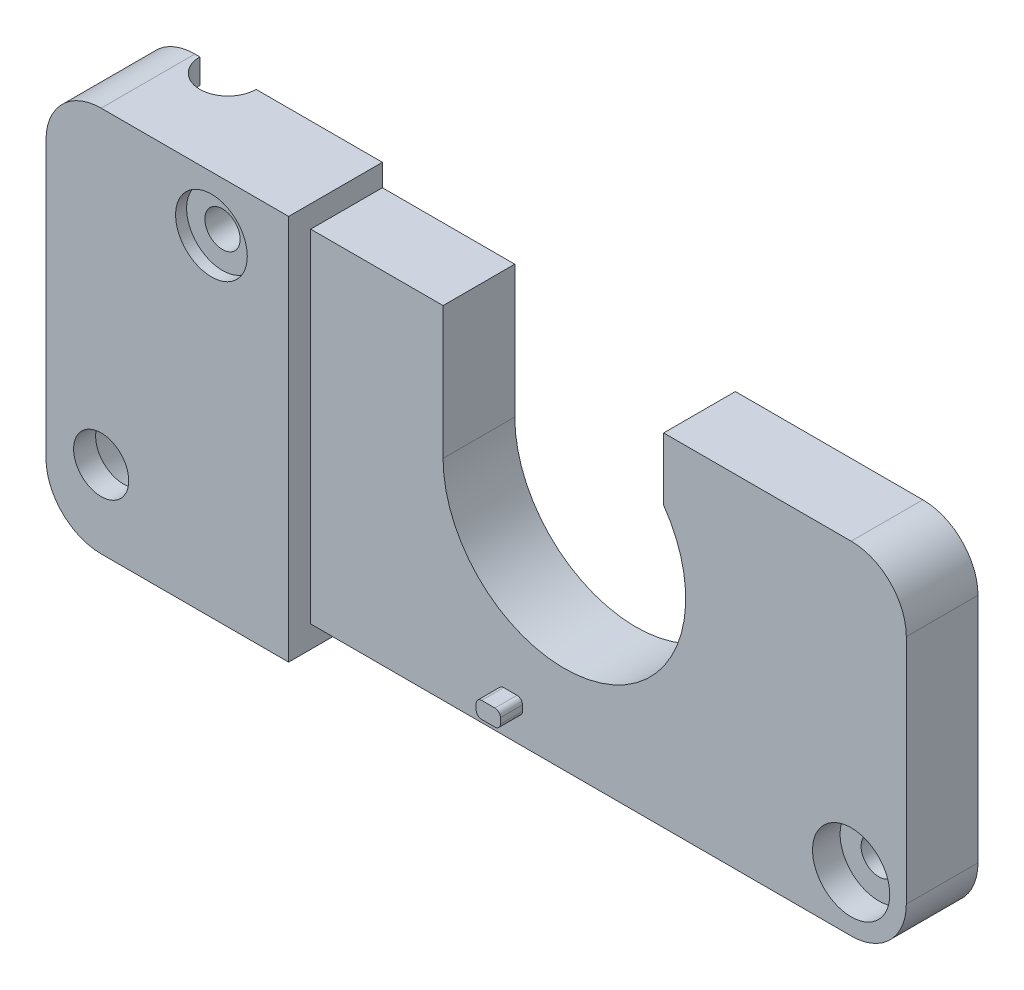
from build123d import *

# Parameters (mm, degrees)
BOSS_EXTRUDE1_DEPTH  = 17
CUT_EXTRUDE1_START   = -17
SKETCH3_W            = 12
SKETCH3_H            = 2
CUT_EXTRUDE1_DEPTH   = 17
CUT_EXTRUDE2_START   = -2
CUT_EXTRUDE2_DEPTH   = 2
SKETCH5_W            = 60
SKETCH5_H            = 35
CUT_EXTRUDE3_DEPTH   = 2
CUT_EXTRUDE4_DEPTH   = 11
CUT_EXTRUDE11_DEPTH  = 13
BOSS_EXTRUDE2_DEPTH  = 2
SKETCH13_R           = 2.5
CUT_EXTRUDE12_DEPTH  = 5
SKETCH14_R           = 2.55
CUT_EXTRUDE14_DEPTH  = 15
BOSS_EXTRUDE5_REACH  = 87.381
SKETCH15_R           = 3.25
SKETCH15_R_2         = 1.6
SKETCH15_4_R         = 3.25
SKETCH15_4_R_2       = 1.6
CUT_EXTRUDE16_DEPTH  = 1
SKETCH18_R           = 1.6
CUT_EXTRUDE17_DEPTH  = 15
SKETCH20_R           = 4.5
SKETCH20_R_2         = 1.6
BOSS_EXTRUDE6_DEPTH  = 13
SKETCH20_3_R         = 1.6
CUT_EXTRUDE20_DEPTH  = 86.005882191
SKETCH22_W           = 13
SKETCH22_H           = 31
SKETCH22_W_2         = 11
SKETCH22_H_2         = 29
BOSS_EXTRUDE7_DEPTH  = 3
SKETCH21_R           = 3.5
CUT_EXTRUDE21_DEPTH  = 2
SKETCH29_R           = 3.5
CUT_EXTRUDE22_DEPTH  = 2.5
BOSS_EXTRUDE10_DEPTH = 13
SKETCH24_W           = 80
SKETCH24_H           = 36
CUT_EXTRUDE23_DEPTH  = 10


with BuildPart() as part:
    # Sketch1 → Boss-Extrude1 (new body)
    with BuildSketch(Plane.XY):
        with BuildLine():
            ThreePointArc((0, 5), (1.464466094, 1.464466094), (5, 0))
            Line((5, 0), (73, 0))
            ThreePointArc((73, 0), (76.535533906, 1.464466094), (78, 5))
            Line((78, 5), (78, 30))
            ThreePointArc((78, 30), (76.535533906, 33.535533906), (73, 35))
            Line((73, 35), (54, 35))
            Line((54, 35), (54, 27.32455532))
            ThreePointArc((54, 27.32455532), (48.31662479, 10.511911518), (34, 21))
            Line((34, 21), (34, 35))
            Line((34, 35), (5, 35))
            ThreePointArc((5, 35), (1.464466094, 33.535533906), (0, 30))
            Line((0, 30), (0, 5))
        make_face()
    extrude(amount=BOSS_EXTRUDE1_DEPTH)

    # Sketch3 → Cut-Extrude1 (cut)
    with BuildSketch(Plane.XY.offset(17).offset(CUT_EXTRUDE1_START)):
        with Locations((28, 34)):
            Rectangle(SKETCH3_W, SKETCH3_H)
        with BuildLine():
            Line((54, 33), (71, 33))
            ThreePointArc((71, 33), (74.535533906, 31.535533906), (76, 28))
            Line((76, 28), (76, 7))
            ThreePointArc((76, 7), (74.535533906, 3.464466094), (71, 2))
            Line((71, 2), (22, 2))
            Line((22, 2), (22, 0))
            Line((22, 0), (73, 0))
            ThreePointArc((73, 0), (76.535533906, 1.464466094), (78, 5))
            Line((78, 5), (78, 30))
            ThreePointArc((78, 30), (76.535533906, 33.535533906), (73, 35))
            Line((73, 35), (54, 35))
            Line((54, 35), (54, 33))
        make_face()
    extrude(amount=CUT_EXTRUDE1_DEPTH, mode=Mode.SUBTRACT)

    # Sketch3<3> → Cut-Extrude2 (cut)
    with BuildSketch(Plane.XY.offset(17).offset(CUT_EXTRUDE2_START)):
        with BuildLine():
            ThreePointArc((76, 28), (74.535533906, 31.535533906), (71, 33))
            Line((71, 33), (54, 33))
            Line((54, 33), (54, 27.32455532))
            ThreePointArc((54, 27.32455532), (48.31662479, 10.511911518), (34, 21))
            Line((34, 21), (34, 33))
            Line((34, 33), (22, 33))
            Line((22, 33), (22, 2))
            Line((22, 2), (71, 2))
            ThreePointArc((71, 2), (74.535533906, 3.464466094), (76, 7))
            Line((76, 7), (76, 28))
        make_face()
    extrude(amount=CUT_EXTRUDE2_DEPTH, mode=Mode.SUBTRACT)

    # Sketch5 → Cut-Extrude3 (cut)
    with BuildSketch(Plane(origin=(0, 0, 0), x_dir=(-1, 0, 0), z_dir=(0, 0, -1))):
        with Locations((-52, 15.5)):
            Rectangle(SKETCH5_W, SKETCH5_H)
    extrude(amount=-CUT_EXTRUDE3_DEPTH, mode=Mode.SUBTRACT)

    # Sketch6 → Cut-Extrude4 (cut)
    with BuildSketch(Plane.XY.offset(14)):
        with BuildLine():
            Line((22, 32), (69.5, 32))
            ThreePointArc((69.5, 32), (73.035533906, 30.535533906), (74.5, 27))
            Line((74.5, 27), (74.5, 8))
            ThreePointArc((74.5, 8), (73.035533906, 4.464466094), (69.5, 3))
            Line((69.5, 3), (22, 3))
            Line((22, 3), (22, 32))
        make_face()
    extrude(amount=-CUT_EXTRUDE4_DEPTH, mode=Mode.SUBTRACT)

    # Sketch11 → Cut-Extrude11 (cut)
    with BuildSketch(Plane.XY.offset(15)):
        with BuildLine():
            Line((22, 2), (7, 2))
            ThreePointArc((7, 2), (3.464466094, 3.464466094), (2, 7))
            Line((2, 7), (2, 28))
            ThreePointArc((2, 28), (3.464466094, 31.535533906), (7, 33))
            Line((7, 33), (22, 33))
            Line((22, 33), (22, 2))
        make_face()
    extrude(amount=-CUT_EXTRUDE11_DEPTH, mode=Mode.SUBTRACT)


with BuildPart() as cut_extrude11_piece_1:
    # of the separate pieces the step leaves, piece 1, a body of its own (cut_extrude11_pieces)
    add(part.part.solids().sort_by_distance((0, 30, 0))[0])

    # Sketch13 → Cut-Extrude12 (cut)
    with BuildSketch(Plane.XY.offset(17)):
        with Locations((5, 7)):
            Circle(SKETCH13_R)
    extrude(amount=-CUT_EXTRUDE12_DEPTH, mode=Mode.SUBTRACT)

    # Sketch14 → Cut-Extrude14 (cut)
    with BuildSketch(Plane(origin=(0, 35, 0), x_dir=(1, 0, 0), z_dir=(0, 1, 0))):
        with Locations(Location((8, -8.5, 0), (0, 0, 270))):
            Circle(SKETCH14_R)
    extrude(amount=-CUT_EXTRUDE14_DEPTH, mode=Mode.SUBTRACT)

    # Sketch15 → Boss-Extrude5 (add, up to next)
    with BuildSketch(Plane.XY.offset(17), mode=Mode.PRIVATE) as boss_extrude5_sk1:
        with Locations((15, 30)):
            Circle(SKETCH15_R)
        with Locations((15, 30)):
            Circle(SKETCH15_R_2, mode=Mode.SUBTRACT)
    boss_extrude5_tool1 = extrude(boss_extrude5_sk1.sketch, amount=-BOSS_EXTRUDE5_REACH, mode=Mode.PRIVATE) - cut_extrude11_piece_1.part
    add(boss_extrude5_tool1.solids().sort_by_distance((11.841924, 30, 17))[0])

    # Sketch15<4> → Cut-Extrude16 (cut)
    with BuildSketch(Plane.XY.offset(17)):
        with Locations((15, 30)):
            Circle(SKETCH15_4_R)
        with Locations((15, 30)):
            Circle(SKETCH15_4_R_2, mode=Mode.SUBTRACT)
    extrude(amount=-CUT_EXTRUDE16_DEPTH, mode=Mode.SUBTRACT)

    # Sketch18 → Cut-Extrude17 (cut)
    with BuildSketch(Plane.XY.offset(17)):
        with Locations((15, 30)):
            Circle(SKETCH18_R)
    extrude(amount=-CUT_EXTRUDE17_DEPTH, mode=Mode.SUBTRACT)

    # Sketch22 → Boss-Extrude7 (add)
    with BuildSketch(Plane(origin=(22, 0, 0), x_dir=(0, 0, -1), z_dir=(1, 0, 0))):
        with Locations((-8.5, 17.5)):
            Rectangle(SKETCH22_W, SKETCH22_H)
        with Locations((-8.5, 17.5)):
            Rectangle(SKETCH22_W_2, SKETCH22_H_2, mode=Mode.SUBTRACT)
    extrude(amount=-BOSS_EXTRUDE7_DEPTH)


with BuildPart() as cut_extrude11_piece_2:
    # of the separate pieces the step leaves, piece 2, a body of its own (cut_extrude11_pieces)
    add(part.part.solids().sort_by_distance((34, 33, 2))[0])

    # Sketch12 → Boss-Extrude2 (add)
    with BuildSketch(Plane.XY.offset(15)):
        with BuildLine():
            Line((39.5, 5.75), (40.7, 5.75))
            ThreePointArc((40.7, 5.75), (41.053553391, 5.603553391), (41.2, 5.25))
            Line((41.2, 5.25), (41.2, 4.75))
            ThreePointArc((41.2, 4.75), (41.053553391, 4.396446609), (40.7, 4.25))
            Line((40.7, 4.25), (39.5, 4.25))
            ThreePointArc((39.5, 4.25), (39.146446609, 4.396446609), (39, 4.75))
            Line((39, 4.75), (39, 5.25))
            ThreePointArc((39, 5.25), (39.146446609, 5.603553391), (39.5, 5.75))
        make_face()
    extrude(amount=BOSS_EXTRUDE2_DEPTH)

    # Sketch20 → Boss-Extrude6 (add)
    with BuildSketch(Plane.XY.offset(15)):
        with Locations((71, 7)):
            Circle(SKETCH20_R)
        with Locations((71, 7)):
            Circle(SKETCH20_R_2, mode=Mode.SUBTRACT)
    extrude(amount=-BOSS_EXTRUDE6_DEPTH)

    # Sketch20<3> → Cut-Extrude20 (cut, through all)
    with BuildSketch(Plane.XY.offset(15)):
        with Locations((71, 7)):
            Circle(SKETCH20_3_R)
    extrude(amount=-CUT_EXTRUDE20_DEPTH, mode=Mode.SUBTRACT)

    # Sketch21 → Cut-Extrude21 (cut)
    with BuildSketch(Plane(origin=(0, 0, 2), x_dir=(-1, 0, 0), z_dir=(0, 0, -1))):
        with Locations((-71, 7)):
            Circle(SKETCH21_R)
    extrude(amount=-CUT_EXTRUDE21_DEPTH, mode=Mode.SUBTRACT)

    # Sketch29 → Cut-Extrude22 (cut)
    with BuildSketch(Plane.XY.offset(15)):
        with Locations(Location((71, 7, 0), (0, 0, 180))):
            Circle(SKETCH29_R)
    extrude(amount=-CUT_EXTRUDE22_DEPTH, mode=Mode.SUBTRACT)

    # Sketch36 → Boss-Extrude10 (add)
    with BuildSketch(Plane.XY.offset(15)):
        with BuildLine():
            Line((34, 21), (34, 33))
            Line((34, 33), (33.3, 33))
            Line((33.3, 33), (33.3, 21))
            ThreePointArc((33.3, 21), (48.314061384, 9.565059525), (54.7, 27.32455532))
            Line((54.7, 27.32455532), (54.7, 33))
            Line((54.7, 33), (54, 33))
            Line((54, 33), (54, 27.32455532))
            ThreePointArc((54, 27.32455532), (48.31662479, 10.511911518), (34, 21))
        make_face()
    extrude(amount=-BOSS_EXTRUDE10_DEPTH)


with BuildPart() as cut_extrude23_tool:
    # Sketch24 → Cut-Extrude23 (new body)
    with BuildSketch(Plane.XY.offset(8.5)):
        with Locations((40, 18)):
            Rectangle(SKETCH24_W, SKETCH24_H)
    extrude(amount=-CUT_EXTRUDE23_DEPTH)


with BuildPart() as cut_extrude11_piece_1_1:
    add(cut_extrude11_piece_1.part)

    # Cut-Extrude23: cut by cut_extrude23_tool
    add(cut_extrude23_tool.part, mode=Mode.SUBTRACT)


with BuildPart() as cut_extrude11_piece_2_1:
    add(cut_extrude11_piece_2.part)

    # Cut-Extrude23: cut by cut_extrude23_tool
    add(cut_extrude23_tool.part, mode=Mode.SUBTRACT)


solid = Compound([cut_extrude11_piece_1_1.part, cut_extrude11_piece_2_1.part])
